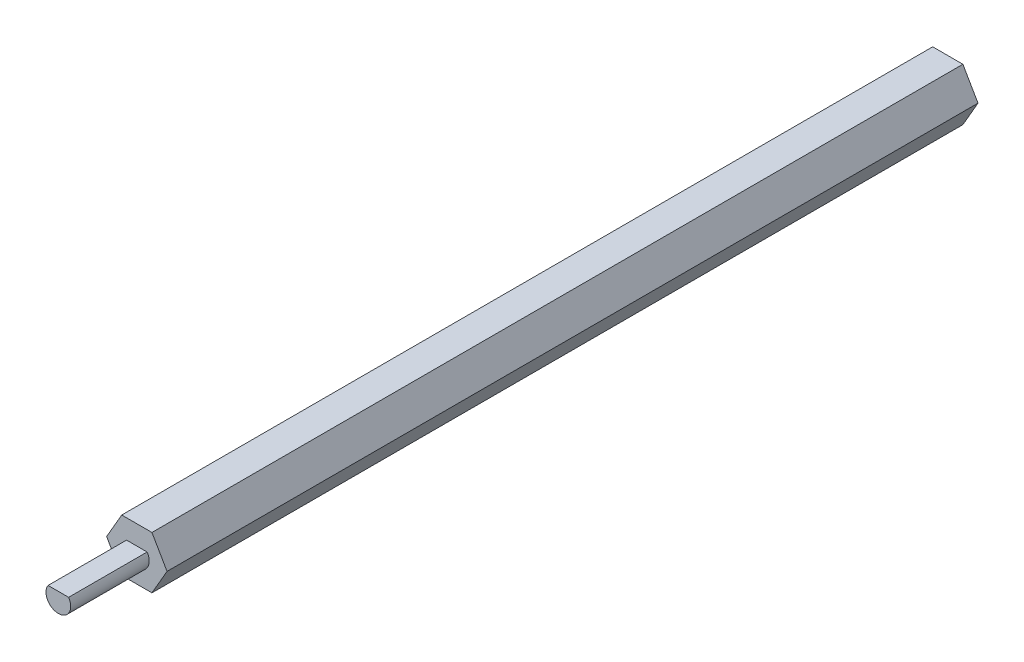
from build123d import *

# Parameters (mm, degrees)
BOSS_EXTRUDE1_DEPTH = 107.95
CUT_EXTRUDE1_DEPTH  = 19.05


with BuildPart() as part:
    # Sketch1 → Boss-Extrude1 (new, symmetric)
    with BuildSketch(Plane.XY):
        Polygon((3.666174209, 6.35), (-3.666174209, 6.35), (-7.332348419, 0), (-3.666174209, -6.35), (3.666174209, -6.35), (7.332348419, 0), align=None)
    extrude(amount=BOSS_EXTRUDE1_DEPTH, both=True)

    # Sketch2 → Cut-Extrude1 (cut)
    with BuildSketch(Plane.XY.offset(107.95)):
        Polygon((-3.666174209, 6.35), (-7.332348419, 0), (-3.666174209, -6.35), (3.666174209, -6.35), (7.332348419, 0), (3.666174209, 6.35), align=None)
        with BuildLine():
            Line((-2.5, 1.658312395), (2.5, 1.658312395))
            ThreePointArc((2.5, 1.658312395), (0, -3), (-2.5, 1.658312395))
        make_face(mode=Mode.SUBTRACT)
    extrude(amount=-CUT_EXTRUDE1_DEPTH, mode=Mode.SUBTRACT)


solid = part.part
